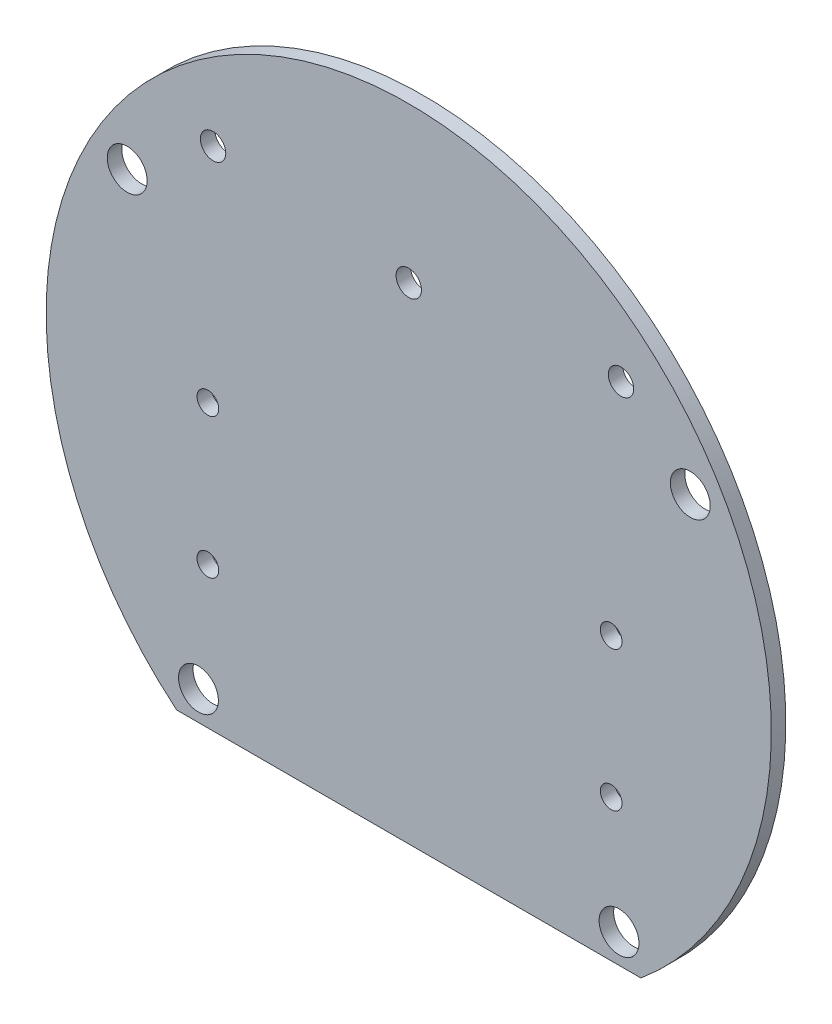
from build123d import *

# Parameters (mm, degrees)
ESBO_O1_R                  = 50
RESSALTO_EXTRUS_O1_DEPTH   = 2
ESBO_O2_R                  = 2.75
CORTE_EXTRUS_O1_DEPTH      = 2
CORTE_EXTRUS_O2_DEPTH      = 71.738956735
CORTE_EXTRUS_O2_DEPTH_BACK = 10
ESBO_O5_R                  = 1.5
ESBO_O5_R_2                = 1.75
CORTE_EXTRUS_O3_DEPTH      = 10


with BuildPart() as part:
    # Esboço1 → Ressalto-extrusão1 (new body)
    with BuildSketch(Plane.XY):
        Circle(ESBO_O1_R)
    extrude(amount=RESSALTO_EXTRUS_O1_DEPTH)

    # Esboço2 → Corte-extrusão1 (cut)
    with BuildSketch(Plane.XY.offset(2)):
        with Locations((-29, -34.409301068)):
            Circle(ESBO_O2_R)
        with Locations((29, -34.409301068)):
            Circle(ESBO_O2_R)
        with Locations((-38.824197531, 22.752619324)):
            Circle(ESBO_O2_R)
        with Locations((38.824197531, 22.752619324)):
            Circle(ESBO_O2_R)
    extrude(amount=-CORTE_EXTRUS_O1_DEPTH, mode=Mode.SUBTRACT)

    # Esboço4 → Corte-extrusão2 (cut, two sides: drawn at the far end of the back side and taken through both)
    with BuildSketch(Plane.XY.offset(2).offset(-CORTE_EXTRUS_O2_DEPTH_BACK)):
        Polygon((-40.723859979, -38.409301068), (44.57073926, -38.409301068), (1.923439641, -68.002213614), align=None)
    extrude(amount=CORTE_EXTRUS_O2_DEPTH + CORTE_EXTRUS_O2_DEPTH_BACK, mode=Mode.SUBTRACT)

    # Esboço5 → Corte-extrusão3 (cut)
    with BuildSketch(Plane(origin=(0, 0, 0), x_dir=(-1, 0, 0), z_dir=(0, 0, -1))):
        with Locations((-27.91, -18.86)):
            Circle(ESBO_O5_R)
        with Locations((27.7, -18.86)):
            Circle(ESBO_O5_R)
        with Locations((27.7, 0.44)):
            Circle(ESBO_O5_R)
        with Locations((-27.91, 0.44)):
            Circle(ESBO_O5_R)
        with Locations((26.98, 31.44)):
            Circle(ESBO_O5_R_2)
        with Locations((0, 28.6)):
            Circle(ESBO_O5_R_2)
        with Locations((-29.27, 31.44)):
            Circle(ESBO_O5_R_2)
    extrude(amount=-CORTE_EXTRUS_O3_DEPTH, mode=Mode.SUBTRACT)


solid = part.part
